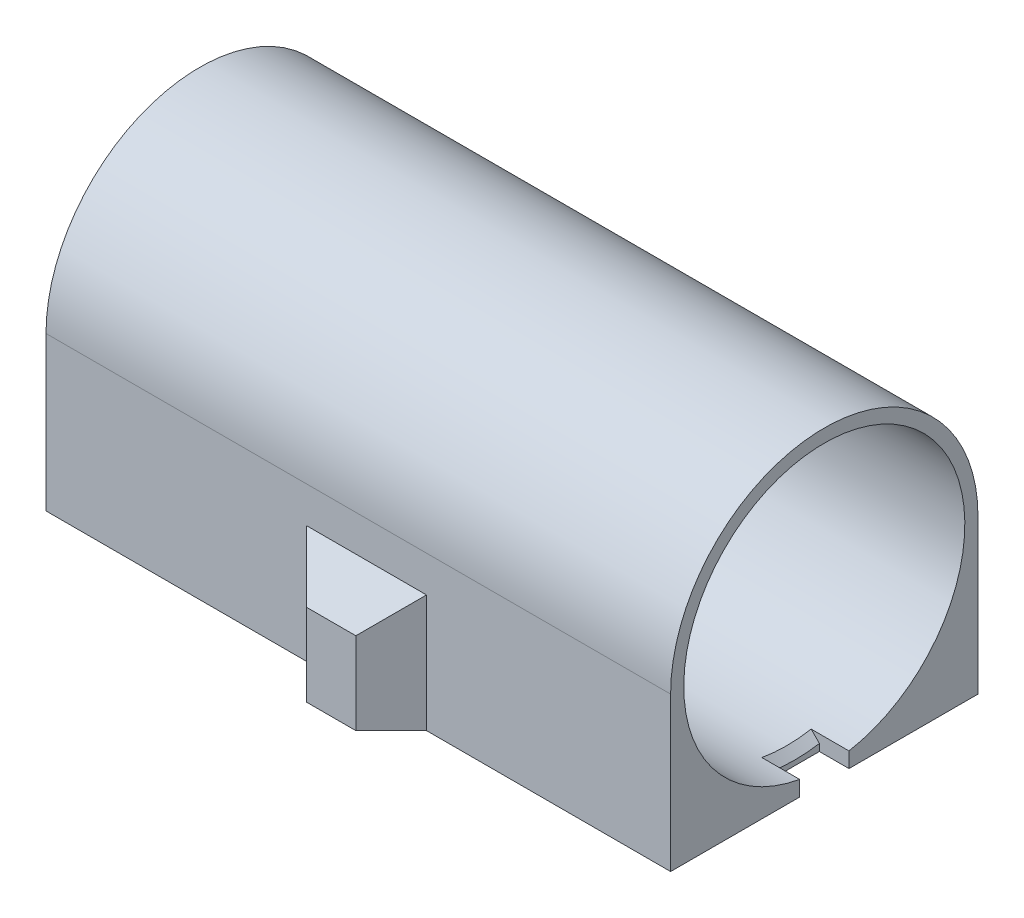
from build123d import *

# Parameters (mm, degrees)
EXTRUDE_1_DEPTH            = 18.5
EXTRUDE_1_DEPTH_BACK       = 19.5
SKETCH_1_R                 = 8.55
SKETCH_6_R                 = 3
EXTRUDE_3_DEPTH            = 2
CUT_EXTRUDE_1_REACH        = 30.59
CUT_EXTRUDE_1_END_RADIUS   = 8.55
SKETCH_2_W                 = 0.8
SKETCH_2_H                 = 3
SKETCH_3_W                 = 3
SKETCH_3_H                 = 0.3
CUT_EXTRUDE_2_DEPTH        = 2
CHAMFER_1_SIZE             = 0.5
CHAMFER_1_OF_MIRROR_1_SIZE = 0.5
CUT_EXTRUDE_START          = -1
CUT_EXTRUDE_4_DEPTH        = 1
CHAMFER_2_SIZE             = 1
EXTRUDE_4_DEPTH            = 5
SKETCH_9_R                 = 1.5
CUT_EXTRUDE_5_DEPTH        = 4
CHAMFER_3_SIZE             = 0.5
CHAMFER_3_OF_MIRROR_2_SIZE = 0.5
DRAFT_3_ANGLE              = 45
DRAFT_4_ANGLE              = 45


with BuildPart() as part:
    # Эскиз1 → Бобышка-Вытянуть1 (new, two sides: drawn at the far end of the back side and taken through both)
    with BuildSketch(Plane(origin=(0, 0, 0), x_dir=(0, 0, -1), z_dir=(1, 0, 0)).offset(-EXTRUDE_1_DEPTH_BACK)):
        with BuildLine():
            Line((-9.35, 0), (-9.35, -9.35))
            Line((-9.35, -9.35), (9.35, -9.35))
            Line((9.35, -9.35), (9.35, 0))
            ThreePointArc((9.35, 0), (0, 9.35), (-9.35, 0))
        make_face()
        Circle(SKETCH_1_R, mode=Mode.SUBTRACT)
    extrude(amount=EXTRUDE_1_DEPTH + EXTRUDE_1_DEPTH_BACK)

    # Эскиз6 → Бобышка-Вытянуть3 (add)
    with BuildSketch(Plane.ZY.offset(19.5)):
        with BuildLine():
            Line((-9.35, -9.35), (9.35, -9.35))
            Line((9.35, -9.35), (9.35, 0))
            ThreePointArc((9.35, 0), (0, 9.35), (-9.35, 0))
            Line((-9.35, 0), (-9.35, -9.35))
        make_face()
        Circle(SKETCH_6_R, mode=Mode.SUBTRACT)
    extrude(amount=-EXTRUDE_3_DEPTH)

    # Вырез-Вытянуть1: up to this cylinder (the profile starts outside it)
    cut_extrude_1_end = Plane(origin=(-17.1, 0, 0), z_dir=(1, 0, 0)) * Cylinder(CUT_EXTRUDE_1_END_RADIUS, 79.28, mode=Mode.PRIVATE)
    # Эскиз2 → Вырез-Вытянуть1 (cut, up to the surface)
    with BuildSketch(Plane.XZ.offset(9.35), mode=Mode.PRIVATE) as cut_extrude_1_sk1:
        with Locations((-17.1, 0)):
            Rectangle(SKETCH_2_W, SKETCH_2_H)
    cut_extrude_1_tool1 = extrude(cut_extrude_1_sk1.sketch, amount=-CUT_EXTRUDE_1_REACH, mode=Mode.PRIVATE) - cut_extrude_1_end
    cut_extrude_1 = cut_extrude_1_tool1.solids().sort_by_distance((-17.1, -9.35, 0))[0]
    add(cut_extrude_1, mode=Mode.SUBTRACT)

    # Эскиз3 → Вырез-Вытянуть2 (cut)
    with BuildSketch(Plane.ZY.offset(19.5)):
        with Locations((0, -9.2)):
            Rectangle(SKETCH_3_W, SKETCH_3_H)
    extrude(amount=-CUT_EXTRUDE_2_DEPTH, mode=Mode.SUBTRACT)

    # Фаска1
    chamfer_1_edges = [part.edges().sort_by_distance(p)[0] for p in [
        (-16.7, -8.55, 0),
    ]]
    chamfer(chamfer_1_edges, length=CHAMFER_1_SIZE)

    # Зеркальное отражение1: Вырез-Вытянуть1 across plane
    add(cut_extrude_1.mirror(Plane(origin=(0, 0, 0), x_dir=(0, 0, 1), z_dir=(1, 0, 0))), mode=Mode.SUBTRACT)

    # Фаска1 of Зеркальное отражение1
    chamfer_1_of_mirror_1_edges = [part.edges().sort_by_distance(p)[0] for p in [
        (16.7, -8.55, 0),
    ]]
    chamfer(chamfer_1_of_mirror_1_edges, length=CHAMFER_1_OF_MIRROR_1_SIZE)

    # Эскиз7 → Вырез-Вытянуть4 (cut)
    with BuildSketch(Plane(origin=(18.5, 0, 0), x_dir=(0, 0, -1), z_dir=(1, 0, 0)).offset(CUT_EXTRUDE_START)):
        with BuildLine():
            Line((1.5, -9.35), (1.5, -8.417392708))
            ThreePointArc((1.5, -8.417392708), (0, -8.55), (-1.5, -8.417392708))
            Line((-1.5, -8.417392708), (-1.5, -9.35))
            Line((-1.5, -9.35), (1.5, -9.35))
        make_face()
    extrude(amount=CUT_EXTRUDE_4_DEPTH, mode=Mode.SUBTRACT)

    # Фаска2
    chamfer_2_edges = [part.edges().sort_by_distance(p)[0] for p in [
        (-17.5, -9.05, 0),
    ]]
    chamfer(chamfer_2_edges, length=CHAMFER_2_SIZE)

    # Эскиз8 → Бобышка-Вытянуть4 (add)
    with BuildSketch(Plane.XZ.offset(9.35)):
        Polygon((-1.5, 11.5), (1.5, 11.5), (3.65, 9.35), (-3.65, 9.35), align=None)
    extrude_4 = extrude(amount=-EXTRUDE_4_DEPTH)

    # Эскиз9 → Вырез-Вытянуть5 (cut)
    with BuildSketch(Plane.XZ.offset(9.35)):
        with Locations(Location((0, 8.5, 0), (0, 0, 270))):
            Circle(SKETCH_9_R)
    cut_extrude_5 = extrude(amount=-CUT_EXTRUDE_5_DEPTH, mode=Mode.SUBTRACT)

    # Фаска3
    chamfer_3_edges = [part.edges().sort_by_distance(p)[0] for p in [
        (0, -9.35, 10),
    ]]
    chamfer(chamfer_3_edges, length=CHAMFER_3_SIZE)

    # Зеркальное отражение2: Бобышка-Вытянуть4, Вырез-Вытянуть5 across plane
    add(extrude_4.mirror(Plane.XY))
    add(cut_extrude_5.mirror(Plane.XY), mode=Mode.SUBTRACT)

    # Фаска3 of Зеркальное отражение2
    chamfer_3_of_mirror_2_edges = [part.edges().sort_by_distance(p)[0] for p in [
        (0, -9.35, -10),
    ]]
    chamfer(chamfer_3_of_mirror_2_edges, length=CHAMFER_3_OF_MIRROR_2_SIZE)

    # Уклон3
    draft_3_faces = [part.faces().sort_by_distance(p)[0] for p in [
        (0, -4.35, 10.275404531),
    ]]
    draft(draft_3_faces, Plane(origin=(-1.5, -4.35, 11.5), x_dir=(1, 0, 0), z_dir=(0, 0, 1)), DRAFT_3_ANGLE)

    # Уклон4
    draft_4_faces = [part.faces().sort_by_distance(p)[0] for p in [
        (0, -4.35, -10.275404531),
    ]]
    draft(draft_4_faces, Plane(origin=(-1.5, -4.35, -11.5), x_dir=(-1, 0, 0), z_dir=(0, 0, -1)), DRAFT_4_ANGLE)


solid = part.part
